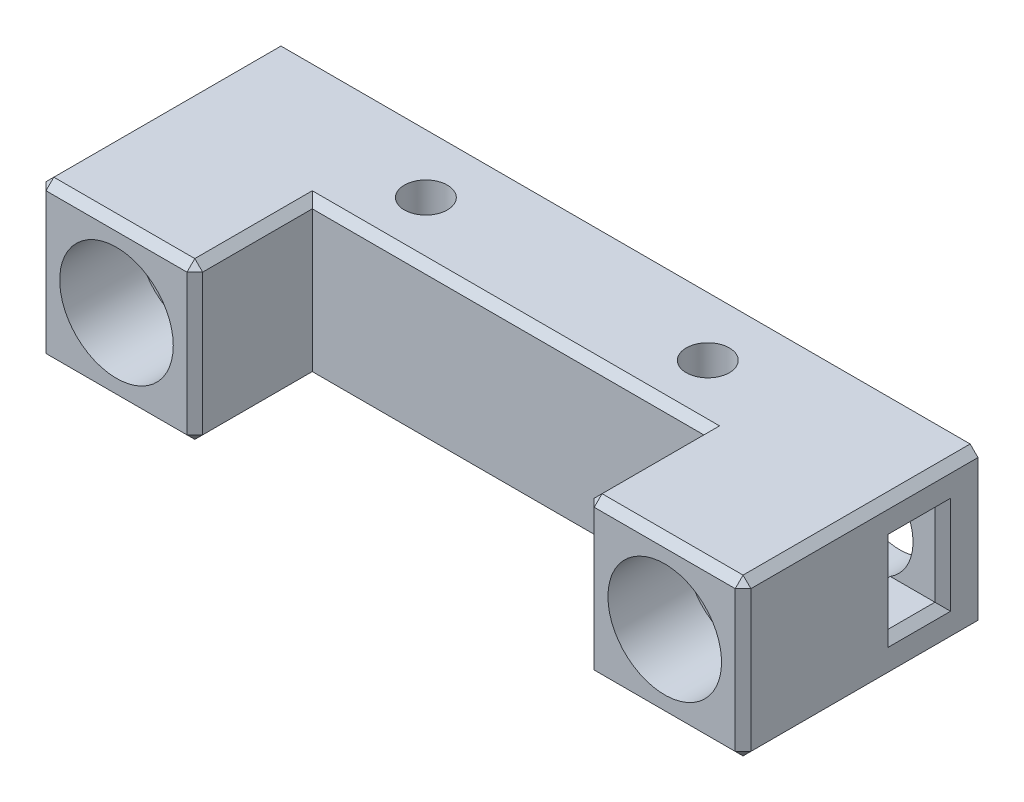
from build123d import *

# Parameters (mm, degrees)
BODY_DEPTH               = 10
SKETCH2_R                = 7.25
SPRING_HOLE_DEPTH        = 10
SKETCH3_R                = 3.25
SHAFT_HOLE_DEPTH         = 51.249378106
FIXATION_HOLE_START      = -20
SKETCH4_R                = 2.75
FIXATION_HOLE_DEPTH      = 72.478150705
SKETCH6_W                = 6
SKETCH6_H                = 10.5
NUT_HOLE_DEPTH           = 20
SKETCH7_R                = 3.2
INSERTS_TOP_DEPTH        = 9.5
SKETCH8_R                = 4.5
M5_SCREW_PLACE_DEPTH     = 5
SKETCH9_R                = 6.2
LINEARBEARINGPLACE_DEPTH = 19
CHAMFER1_SIZE            = 1
CHAMFER2_SIZE            = 1


with BuildPart() as part:
    # Sketch1 → Body (new, symmetric)
    with BuildSketch(Plane(origin=(0, 0, 0), x_dir=(1, 0, 0), z_dir=(0, 1, 0))):
        Polygon((-45, 15), (45, 15), (45, -5), (45, -15), (25, -15), (25, 0), (-25, 0), (-25, -15), (-45, -15), (-45, -5), align=None)
    extrude(amount=BODY_DEPTH, both=True)

    # Sketch2 → Spring_Hole (cut)
    with BuildSketch(Plane.XY.offset(15)):
        with Locations((-35, 0)):
            Circle(SKETCH2_R)
    spring_hole = extrude(amount=-SPRING_HOLE_DEPTH, mode=Mode.SUBTRACT)

    # Sketch3 → Shaft_Hole (cut, symmetric)
    with BuildSketch(Plane.XY.offset(5)):
        with Locations((-35, 0)):
            Circle(SKETCH3_R)
    shaft_hole = extrude(amount=SHAFT_HOLE_DEPTH, both=True, mode=Mode.SUBTRACT)

    # Sketch4 → Fixation_Hole (cut, through all)
    with BuildSketch(Plane(origin=(0, 10, 0), x_dir=(1, 0, 0), z_dir=(0, 1, 0)).offset(FIXATION_HOLE_START)):
        with Locations(Location((-18, 7.5, 0), (0, 0, 270))):
            Circle(SKETCH4_R)
    fixation_hole = extrude(amount=FIXATION_HOLE_DEPTH, mode=Mode.SUBTRACT)

    # Sketch6 → Nut_Hole (cut)
    with BuildSketch(Plane.ZY.offset(45)):
        with Locations((-7.5, 0)):
            Rectangle(SKETCH6_W, SKETCH6_H)
    nut_hole = extrude(amount=-NUT_HOLE_DEPTH, mode=Mode.SUBTRACT)

    # Mirror1: Spring_Hole, Shaft_Hole, Fixation_Hole, Nut_Hole across plane
    add(spring_hole.mirror(Plane(origin=(0, 0, 0), x_dir=(0, 0, 1), z_dir=(1, 0, 0))), mode=Mode.SUBTRACT)
    add(shaft_hole.mirror(Plane(origin=(0, 0, 0), x_dir=(0, 0, 1), z_dir=(1, 0, 0))), mode=Mode.SUBTRACT)
    add(fixation_hole.mirror(Plane(origin=(0, 0, 0), x_dir=(0, 0, 1), z_dir=(1, 0, 0))), mode=Mode.SUBTRACT)
    add(nut_hole.mirror(Plane(origin=(0, 0, 0), x_dir=(0, 0, 1), z_dir=(1, 0, 0))), mode=Mode.SUBTRACT)

    # Sketch7 → Inserts_Top (cut)
    with BuildSketch(Plane(origin=(0, 0, -15), x_dir=(-1, 0, 0), z_dir=(0, 0, -1))):
        with Locations((-10, 0)):
            Circle(SKETCH7_R)
        with Locations(Location((10, 0, 0), (0, 0, 180))):
            Circle(SKETCH7_R)
    extrude(amount=-INSERTS_TOP_DEPTH, mode=Mode.SUBTRACT)

    # Sketch8 → M5_Screw_Place (cut)
    with BuildSketch(Plane.XZ.offset(10)):
        with Locations(Location((-18, -7.5, 0), (0, 0, 270))):
            Circle(SKETCH8_R)
        with Locations(Location((18, -7.5, 0), (0, 0, 270))):
            Circle(SKETCH8_R)
    extrude(amount=-M5_SCREW_PLACE_DEPTH, mode=Mode.SUBTRACT)

    # Sketch9 → LinearBearingPlace (cut)
    with BuildSketch(Plane(origin=(0, 0, -15), x_dir=(-1, 0, 0), z_dir=(0, 0, -1))):
        with Locations((-35, 0)):
            Circle(SKETCH9_R)
    linearbearingplace = extrude(amount=-LINEARBEARINGPLACE_DEPTH, mode=Mode.SUBTRACT)

    # Mirror2: LinearBearingPlace across plane
    add(linearbearingplace.mirror(Plane(origin=(0, 0, 0), x_dir=(0, 0, 1), z_dir=(1, 0, 0))), mode=Mode.SUBTRACT)

    # Chamfer1
    chamfer1_edges = [part.edges().sort_by_distance(p)[0] for p in [
        (0, -10, 0),
        (-25, -10, 7.5),
        (-35, -10, 15),
        (-45, -10, 0),
        (45, -10, 0),
        (45, 10, 0),
        (35, -10, 15),
        (25, -10, 7.5),
        (-25, 0, 15),
        (-45, 0, 15),
        (45, 0, 15),
        (25, 0, 15),
        (-45, 10, 0),
        (-35, 10, 15),
        (-25, 10, 7.5),
        (0, 10, 0),
        (25, 10, 7.5),
        (35, 10, 15),
    ]]
    chamfer(chamfer1_edges, length=CHAMFER1_SIZE)

    # Chamfer2
    chamfer2_edges = [part.edges().sort_by_distance(p)[0] for p in [
        (-45, 0, -4.5),
        (-45, 5.25, -7.5),
        (-45, 0, -10.5),
        (-45, -5.25, -7.5),
        (45, 0, -4.5),
        (45, 5.25, -7.5),
        (45, 0, -10.5),
        (45, -5.25, -7.5),
    ]]
    chamfer(chamfer2_edges, length=CHAMFER2_SIZE)


solid = part.part
